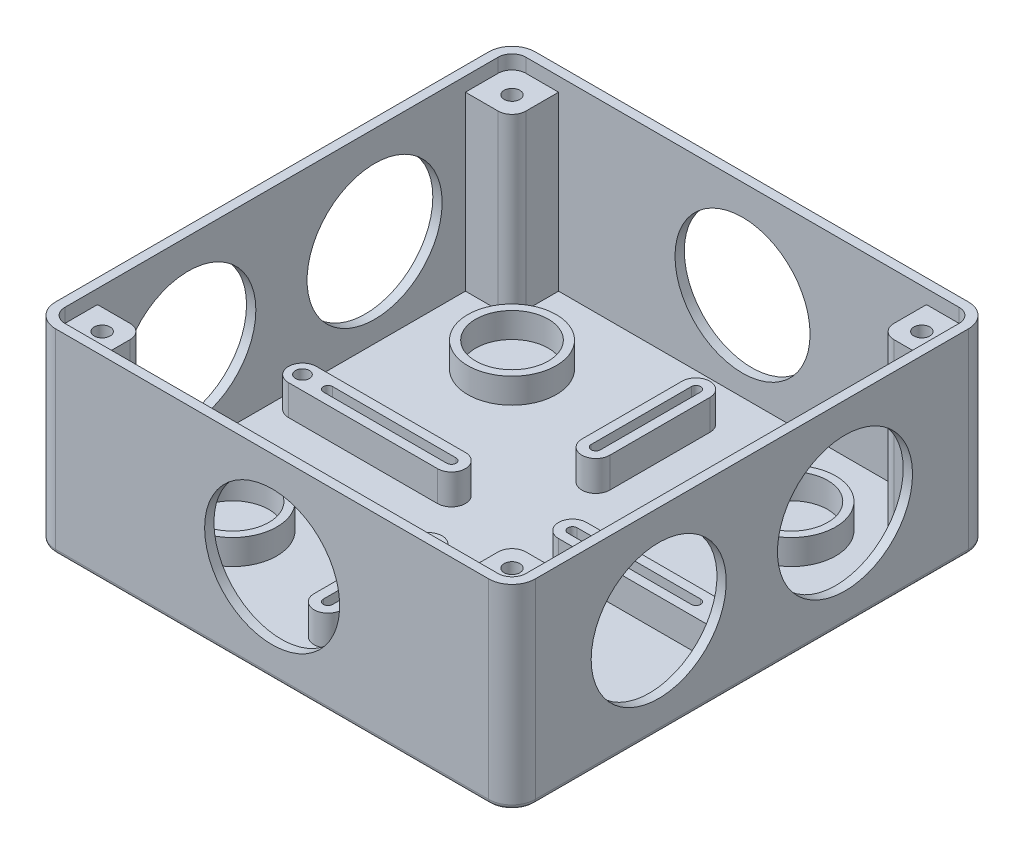
from build123d import *

# Parameters (mm, degrees)
BOSS_EXTRUDE1_DEPTH     = 42
FILLET1_R               = 1
SHELL1_T                = -2
SKETCH2_R               = 4
BOSS_EXTRUDE2_DEPTH     = 1.2
SKETCH3_R               = 14.5
CUT_EXTRUDE1_DEPTH      = 123.577526572
CUT_EXTRUDE2_DEPTH      = 85.0743719
CUT_EXTRUDE2_DEPTH_BACK = 85.0743719
SKETCH4_R               = 14.5
SKETCH5_W               = 48.7
SKETCH5_H               = 48.7
SKETCH5_W_2             = 44.7
SKETCH5_H_2             = 44.7
SKETCH5_W_3             = 19
SKETCH5_H_3             = 19
SKETCH5_W_4             = 15
SKETCH5_H_4             = 15
BOSS_EXTRUDE3_DEPTH     = 1.2
EXTRUDE_THIN1_START     = -1.2
EXTRUDE_THIN1_DEPTH     = 1.2
EXTRUDE_THIN2_START     = -1.2
EXTRUDE_THIN2_DEPTH     = 1.2
SKETCH8_R               = 9.5
SKETCH8_R_2             = 7.8
EXTRUDE_THIN3_DEPTH     = 5.4
SKETCH9_R               = 1.5
BOSS_EXTRUDE4_DEPTH     = 6.5
CUT_EXTRUDE3_DEPTH      = 6.5
SKETCH12_R              = 1.7
BOSS_EXTRUDE5_DEPTH     = 37
BOSS_EXTRUDE6_DEPTH     = 6.5


with BuildPart() as part:
    # Sketch1 → Boss-Extrude1 (new body)
    with BuildSketch(Plane(origin=(0, 0, 0), x_dir=(1, 0, 0), z_dir=(0, 1, 0))):
        with BuildLine():
            Line((51.5, -46.5), (51.5, 46.5))
            ThreePointArc((51.5, 46.5), (50.035533906, 50.035533906), (46.5, 51.5))
            Line((46.5, 51.5), (-46.5, 51.5))
            ThreePointArc((-46.5, 51.5), (-50.035533906, 50.035533906), (-51.5, 46.5))
            Line((-51.5, 46.5), (-51.5, -46.5))
            ThreePointArc((-51.5, -46.5), (-50.035533906, -50.035533906), (-46.5, -51.5))
            Line((-46.5, -51.5), (46.5, -51.5))
            ThreePointArc((46.5, -51.5), (50.035533906, -50.035533906), (51.5, -46.5))
        make_face()
    extrude(amount=BOSS_EXTRUDE1_DEPTH)

    # Fillet1
    fillet1_edges = [part.edges().sort_by_distance(p)[0] for p in [
        (0, 0, -51.5),
        (50.035533906, 0, -50.035533906),
        (51.5, 0, 0),
        (50.035533906, 0, 50.035533906),
        (0, 0, 51.5),
        (-50.035533906, 0, 50.035533906),
        (-51.5, 0, 0),
        (-50.035533906, 0, -50.035533906),
    ]]
    fillet(fillet1_edges, radius=FILLET1_R)

    # Shell1
    shell1_openings = [part.faces().sort_by_distance(p)[0] for p in [
        (0, 42, 0),
    ]]
    offset(amount=SHELL1_T, openings=shell1_openings, kind=Kind.INTERSECTION)

    # Sketch2 → Boss-Extrude2 (add)
    with BuildSketch(Plane.XZ):
        with BuildLine():
            Line((30, 39), (-30, 39))
            ThreePointArc((-30, 39), (-36.363961031, 36.363961031), (-39, 30))
            Line((-39, 30), (-39, -30))
            ThreePointArc((-39, -30), (-36.363961031, -36.363961031), (-30, -39))
            Line((-30, -39), (30, -39))
            ThreePointArc((30, -39), (36.363961031, -36.363961031), (39, -30))
            Line((39, -30), (39, 30))
            ThreePointArc((39, 30), (36.363961031, 36.363961031), (30, 39))
        make_face()
        with Locations(Location((30, 30, 0), (0, 0, 270))):
            Circle(SKETCH2_R, mode=Mode.SUBTRACT)
        with Locations(Location((30, -30, 0), (0, 0, 90))):
            Circle(SKETCH2_R, mode=Mode.SUBTRACT)
        with Locations(Location((-30, -30, 0), (0, 0, 270))):
            Circle(SKETCH2_R, mode=Mode.SUBTRACT)
        with Locations(Location((-30, 30, 0), (0, 0, 90))):
            Circle(SKETCH2_R, mode=Mode.SUBTRACT)
        with BuildLine():
            Line((24.343145751, 37), (-24.343145751, 37))
            ThreePointArc((-24.343145751, 37), (-23.636038969, 23.636038969), (-37, 24.343145751))
            Line((-37, 24.343145751), (-37, -24.343145751))
            ThreePointArc((-37, -24.343145751), (-23.636038969, -23.636038969), (-24.343145751, -37))
            Line((-24.343145751, -37), (24.343145751, -37))
            ThreePointArc((24.343145751, -37), (23.636038969, -23.636038969), (37, -24.343145751))
            Line((37, -24.343145751), (37, 24.343145751))
            ThreePointArc((37, 24.343145751), (23.636038969, 23.636038969), (24.343145751, 37))
        make_face(mode=Mode.SUBTRACT)
    extrude(amount=BOSS_EXTRUDE2_DEPTH)

    # Sketch3 → Cut-Extrude1 (cut, through all)
    with BuildSketch(Plane(origin=(0, 0, -51.5), x_dir=(-1, 0, 0), z_dir=(0, 0, -1))):
        with Locations((0, 21)):
            Circle(SKETCH3_R)
    extrude(amount=-CUT_EXTRUDE1_DEPTH, mode=Mode.SUBTRACT)

    # Sketch4 → Cut-Extrude2 (cut, two sides: drawn at the far end of the back side and taken through both)
    with BuildSketch(Plane(origin=(0, 0, 0), x_dir=(0, 0, -1), z_dir=(1, 0, 0)).offset(-CUT_EXTRUDE2_DEPTH_BACK)):
        with Locations((20, 21)):
            Circle(SKETCH4_R)
        with Locations(Location((-20, 21, 0), (0, 0, 180))):
            Circle(SKETCH4_R)
    extrude(amount=CUT_EXTRUDE2_DEPTH + CUT_EXTRUDE2_DEPTH_BACK, mode=Mode.SUBTRACT)

    # Sketch5 → Boss-Extrude3 (add)
    # profile 1 of 2: a face of its own
    with BuildSketch(Plane.XZ):
        Rectangle(SKETCH5_W, SKETCH5_H)
        Rectangle(SKETCH5_W_2, SKETCH5_H_2, mode=Mode.SUBTRACT)
    # profile 2 of 2: a face of its own
    with BuildSketch(Plane.XZ):
        Rectangle(SKETCH5_W_3, SKETCH5_H_3)
        Rectangle(SKETCH5_W_4, SKETCH5_H_4, mode=Mode.SUBTRACT)
    extrude(amount=BOSS_EXTRUDE3_DEPTH)

    # Sketch6 → Extrude-Thin1 (add)
    with BuildSketch(Plane.XZ.offset(1.2).offset(EXTRUDE_THIN1_START)):
        Polygon((8.207106781, 6.792893219), (27.878679656, 26.464466094), (26.464466094, 27.878679656), (6.792893219, 8.207106781), align=None)
    extrude_thin1 = extrude(amount=EXTRUDE_THIN1_DEPTH)

    # Sketch7 → Extrude-Thin2 (add)
    with BuildSketch(Plane.XZ.offset(1.2).offset(EXTRUDE_THIN2_START)):
        Polygon((6.792893219, -8.207106781), (26.464466094, -27.878679656), (27.878679656, -26.464466094), (8.207106781, -6.792893219), align=None)
    extrude_thin2 = extrude(amount=EXTRUDE_THIN2_DEPTH)

    # Mirror1: Extrude-Thin1, Extrude-Thin2 across plane
    add(extrude_thin1.mirror(Plane(origin=(0, 0, 0), x_dir=(0, 0, 1), z_dir=(1, 0, 0))))
    add(extrude_thin2.mirror(Plane(origin=(0, 0, 0), x_dir=(0, 0, 1), z_dir=(1, 0, 0))))

    # Sketch8 → Extrude-Thin3 (add)
    # profile 1 of 4: a face of its own
    with BuildSketch(Plane(origin=(0, 2, 0), x_dir=(1, 0, 0), z_dir=(0, 1, 0))):
        with Locations((30, 30)):
            Circle(SKETCH8_R)
        with Locations((30, 30)):
            Circle(SKETCH8_R_2, mode=Mode.SUBTRACT)
    # profile 2 of 4: a face of its own
    with BuildSketch(Plane(origin=(0, 2, 0), x_dir=(1, 0, 0), z_dir=(0, 1, 0))):
        with Locations((-30, 30)):
            Circle(SKETCH8_R)
        with Locations((-30, 30)):
            Circle(SKETCH8_R_2, mode=Mode.SUBTRACT)
    # profile 3 of 4: a face of its own
    with BuildSketch(Plane(origin=(0, 2, 0), x_dir=(1, 0, 0), z_dir=(0, 1, 0))):
        with Locations((30, -30)):
            Circle(SKETCH8_R)
        with Locations((30, -30)):
            Circle(SKETCH8_R_2, mode=Mode.SUBTRACT)
    # profile 4 of 4: a face of its own
    with BuildSketch(Plane(origin=(0, 2, 0), x_dir=(1, 0, 0), z_dir=(0, 1, 0))):
        with Locations((-30, -30)):
            Circle(SKETCH8_R)
        with Locations((-30, -30)):
            Circle(SKETCH8_R_2, mode=Mode.SUBTRACT)
    extrude(amount=EXTRUDE_THIN3_DEPTH)

    # Sketch9 → Boss-Extrude4 (add)
    # profile 1 of 2: a face of its own
    with BuildSketch(Plane(origin=(0, 2, 0), x_dir=(1, 0, 0), z_dir=(0, 1, 0))):
        with BuildLine():
            Line((-13, 3), (-45, 3))
            ThreePointArc((-45, 3), (-48, 0), (-45, -3))
            Line((-45, -3), (-13, -3))
            ThreePointArc((-13, -3), (-10, 0), (-13, 3))
        make_face()
        with Locations(Location((-45, 0, 0), (0, 0, 90))):
            Circle(SKETCH9_R, mode=Mode.SUBTRACT)
    # profile 2 of 2: a face of its own
    with BuildSketch(Plane(origin=(0, 2, 0), x_dir=(1, 0, 0), z_dir=(0, 1, 0))):
        with BuildLine():
            Line((13, 3), (45, 3))
            ThreePointArc((45, 3), (48, 0), (45, -3))
            Line((45, -3), (13, -3))
            ThreePointArc((13, -3), (10, 0), (13, 3))
        make_face()
        with Locations(Location((45, 0, 0), (0, 0, 90))):
            Circle(SKETCH9_R, mode=Mode.SUBTRACT)
    extrude(amount=BOSS_EXTRUDE4_DEPTH)

    # Sketch10 → Cut-Extrude3 (cut)
    with BuildSketch(Plane(origin=(0, 8.5, 0), x_dir=(1, 0, 0), z_dir=(0, 1, 0))):
        with BuildLine():
            Line((13, 1), (39.5, 1))
            ThreePointArc((39.5, 1), (40.5, 0), (39.5, -1))
            Line((39.5, -1), (13, -1))
            ThreePointArc((13, -1), (12, 0), (13, 1))
        make_face()
        with BuildLine():
            Line((-13, 1), (-39.5, 1))
            ThreePointArc((-39.5, 1), (-40.5, 0), (-39.5, -1))
            Line((-39.5, -1), (-13, -1))
            ThreePointArc((-13, -1), (-12, 0), (-13, 1))
        make_face()
    extrude(amount=-CUT_EXTRUDE3_DEPTH, mode=Mode.SUBTRACT)

    # Sketch12 → Boss-Extrude5 (add)
    # profile 1 of 4: a face of its own
    with BuildSketch(Plane(origin=(0, 2, 0), x_dir=(1, 0, 0), z_dir=(0, 1, 0))):
        with BuildLine():
            Line((39.5, 49.5), (39.5, 42.5))
            ThreePointArc((39.5, 42.5), (40.378679656, 40.378679656), (42.5, 39.5))
            Line((42.5, 39.5), (49.5, 39.5))
            Line((49.5, 39.5), (49.5, 46.5))
            ThreePointArc((49.5, 46.5), (48.621320344, 48.621320344), (46.5, 49.5))
            Line((46.5, 49.5), (39.5, 49.5))
        make_face()
        with Locations(Location((44, 44, 0), (0, 0, 270))):
            Circle(SKETCH12_R, mode=Mode.SUBTRACT)
    # profile 2 of 4: a face of its own
    with BuildSketch(Plane(origin=(0, 2, 0), x_dir=(1, 0, 0), z_dir=(0, 1, 0))):
        with BuildLine():
            Line((39.5, -49.5), (46.5, -49.5))
            ThreePointArc((46.5, -49.5), (48.621320344, -48.621320344), (49.5, -46.5))
            Line((49.5, -46.5), (49.5, -39.5))
            Line((49.5, -39.5), (42.5, -39.5))
            ThreePointArc((42.5, -39.5), (40.378679656, -40.378679656), (39.5, -42.5))
            Line((39.5, -42.5), (39.5, -49.5))
        make_face()
        with Locations(Location((44, -44, 0), (0, 0, 90))):
            Circle(SKETCH12_R, mode=Mode.SUBTRACT)
    # profile 3 of 4: a face of its own
    with BuildSketch(Plane(origin=(0, 2, 0), x_dir=(1, 0, 0), z_dir=(0, 1, 0))):
        with BuildLine():
            Line((-39.5, -49.5), (-39.5, -42.5))
            ThreePointArc((-39.5, -42.5), (-40.378679656, -40.378679656), (-42.5, -39.5))
            Line((-42.5, -39.5), (-49.5, -39.5))
            Line((-49.5, -39.5), (-49.5, -46.5))
            ThreePointArc((-49.5, -46.5), (-48.621320344, -48.621320344), (-46.5, -49.5))
            Line((-46.5, -49.5), (-39.5, -49.5))
        make_face()
        with Locations(Location((-44, -44, 0), (0, 0, 270))):
            Circle(SKETCH12_R, mode=Mode.SUBTRACT)
    # profile 4 of 4: a face of its own
    with BuildSketch(Plane(origin=(0, 2, 0), x_dir=(1, 0, 0), z_dir=(0, 1, 0))):
        with BuildLine():
            Line((-39.5, 49.5), (-46.5, 49.5))
            ThreePointArc((-46.5, 49.5), (-48.621320344, 48.621320344), (-49.5, 46.5))
            Line((-49.5, 46.5), (-49.5, 39.5))
            Line((-49.5, 39.5), (-42.5, 39.5))
            ThreePointArc((-42.5, 39.5), (-40.378679656, 40.378679656), (-39.5, 42.5))
            Line((-39.5, 42.5), (-39.5, 49.5))
        make_face()
        with Locations(Location((-44, 44, 0), (0, 0, 90))):
            Circle(SKETCH12_R, mode=Mode.SUBTRACT)
    extrude(amount=BOSS_EXTRUDE5_DEPTH)

    # Sketch13 → Boss-Extrude6 (add)
    # profile 1 of 2: a face of its own
    with BuildSketch(Plane(origin=(0, 2, 0), x_dir=(1, 0, 0), z_dir=(0, 1, 0))):
        with BuildLine():
            Line((-3, 18), (-3, 39.5))
            ThreePointArc((-3, 39.5), (0, 42.5), (3, 39.5))
            Line((3, 39.5), (3, 18))
            ThreePointArc((3, 18), (0, 15), (-3, 18))
        make_face()
        with BuildLine():
            Line((-1, 18), (-1, 39.5))
            ThreePointArc((-1, 39.5), (0, 40.5), (1, 39.5))
            Line((1, 39.5), (1, 18))
            ThreePointArc((1, 18), (0, 17), (-1, 18))
        make_face(mode=Mode.SUBTRACT)
    # profile 2 of 2: a face of its own
    with BuildSketch(Plane(origin=(0, 2, 0), x_dir=(1, 0, 0), z_dir=(0, 1, 0))):
        with BuildLine():
            Line((-3, -18), (-3, -39.5))
            ThreePointArc((-3, -39.5), (0, -42.5), (3, -39.5))
            Line((3, -39.5), (3, -18))
            ThreePointArc((3, -18), (0, -15), (-3, -18))
        make_face()
        with BuildLine():
            Line((-1, -18), (-1, -39.5))
            ThreePointArc((-1, -39.5), (0, -40.5), (1, -39.5))
            Line((1, -39.5), (1, -18))
            ThreePointArc((1, -18), (0, -17), (-1, -18))
        make_face(mode=Mode.SUBTRACT)
    extrude(amount=BOSS_EXTRUDE6_DEPTH)


solid = part.part
